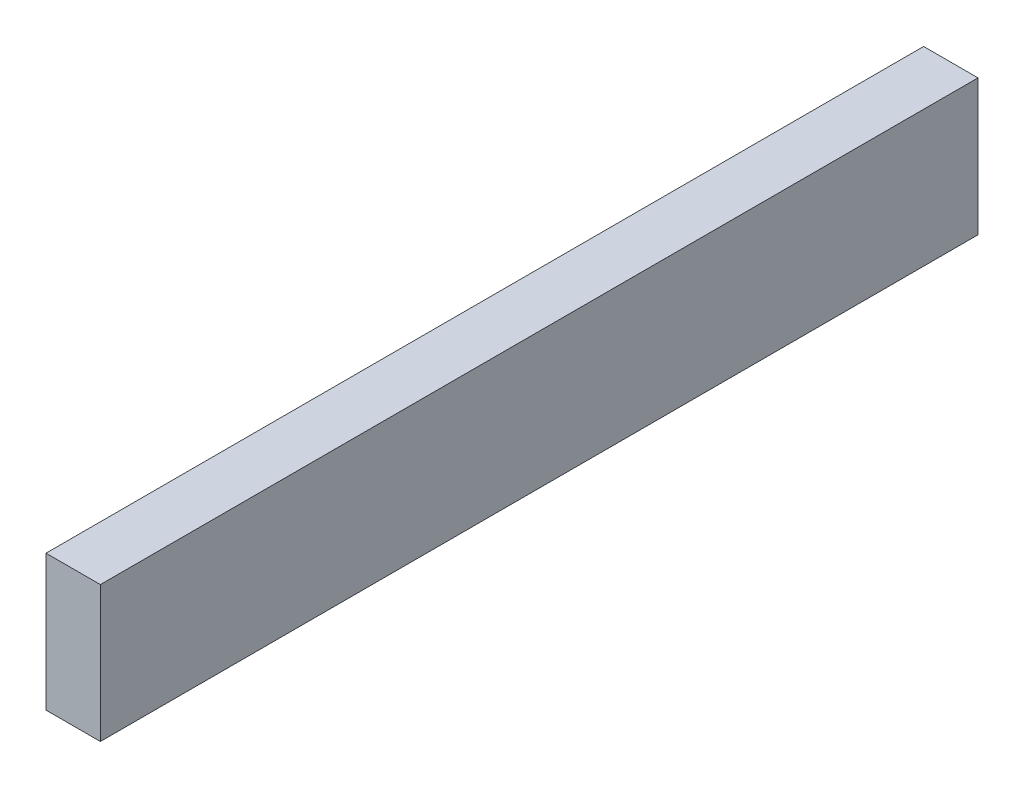
from build123d import *

# Parameters (mm, degrees)
SKETCH1_W           = 50.8
SKETCH1_H           = 127
BOSS_EXTRUDE1_DEPTH = 820


with BuildPart() as part:
    # Sketch1 → Boss-Extrude1 (new body)
    with BuildSketch(Plane.XY):
        with Locations((25.4, 63.5)):
            Rectangle(SKETCH1_W, SKETCH1_H)
    extrude(amount=BOSS_EXTRUDE1_DEPTH)


solid = part.part
